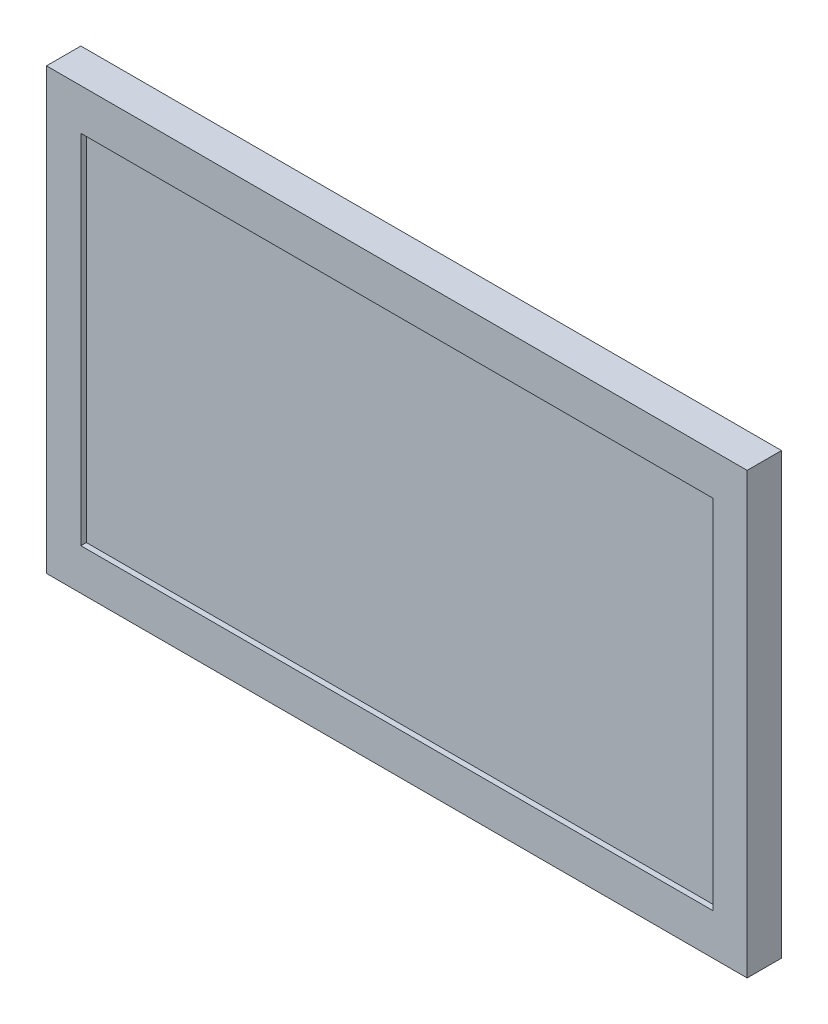
from build123d import *

# Parameters (mm, degrees)
SKETCH1_W           = 323.85
SKETCH1_H           = 203.2
BOSS_EXTRUDE1_DEPTH = 15.875
SKETCH2_W           = 292.1
SKETCH2_H           = 165.1
CUT_EXTRUDE1_DEPTH  = 2.54
SKETCH3_R           = 2.3749
CUT_EXTRUDE2_DEPTH  = 2.54


with BuildPart() as part:
    # Sketch1 → Boss-Extrude1 (new body)
    with BuildSketch(Plane.XY):
        Rectangle(SKETCH1_W, SKETCH1_H)
    extrude(amount=BOSS_EXTRUDE1_DEPTH)

    # Sketch2 → Cut-Extrude1 (cut)
    with BuildSketch(Plane.XY.offset(15.875)):
        Rectangle(SKETCH2_W, SKETCH2_H)
    extrude(amount=-CUT_EXTRUDE1_DEPTH, mode=Mode.SUBTRACT)

    # Sketch3 → Cut-Extrude2 (cut)
    with BuildSketch(Plane(origin=(0, 0, 0), x_dir=(-1, 0, 0), z_dir=(0, 0, -1))):
        with Locations((-37.5, 37.5)):
            Circle(SKETCH3_R)
        with Locations((37.5, 37.5)):
            Circle(SKETCH3_R)
        with Locations((37.5, -37.5)):
            Circle(SKETCH3_R)
        with Locations((-37.5, -37.5)):
            Circle(SKETCH3_R)
    extrude(amount=-CUT_EXTRUDE2_DEPTH, mode=Mode.SUBTRACT)


solid = part.part
